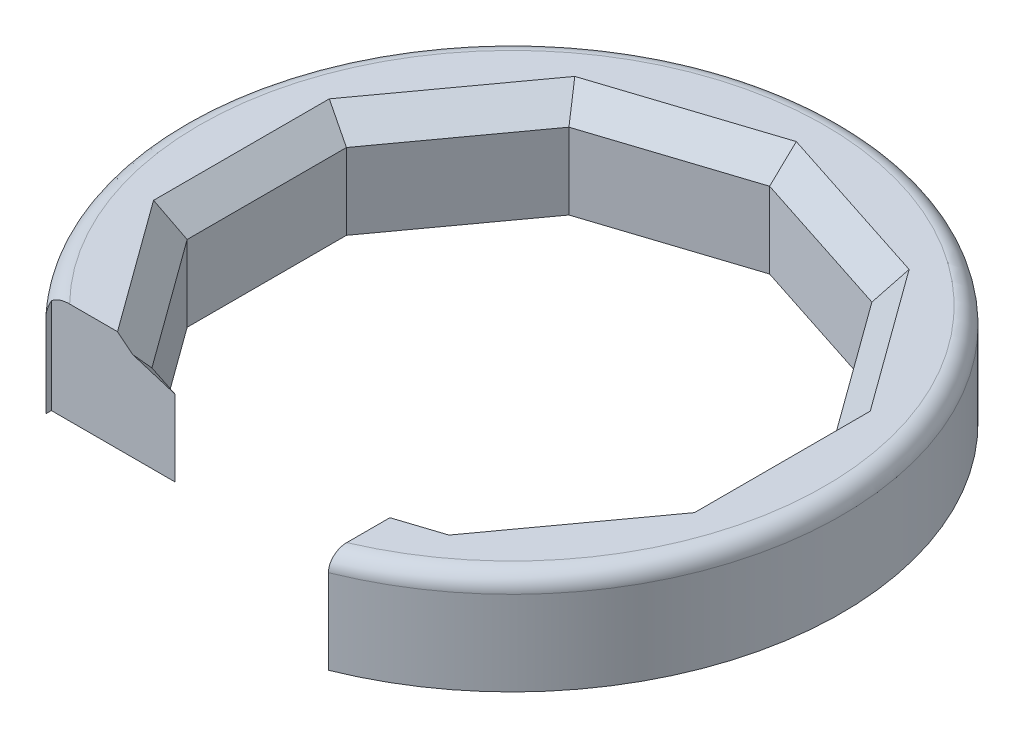
from build123d import *

# Parameters (mm, degrees)
SKETCH1_R           = 39
BOSS_EXTRUDE1_DEPTH = 12
FILLET1_R           = 2
CHAMFER1_SIZE       = 3
SKETCH2_W           = 43
SKETCH2_H           = 43
CUT_EXTRUDE2_DEPTH  = 57.444663167


with BuildPart() as part:
    # Sketch1 → Boss-Extrude1 (new body)
    with BuildSketch(Plane(origin=(0, 0, 0), x_dir=(1, 0, 0), z_dir=(0, 1, 0))):
        with Locations(Location((0, 0, 0), (0, 0, 270))):
            Circle(SKETCH1_R)
        Polygon((17.922985674, 24.668873442), (0, 30.492404503), (-17.922985674, 24.668873442), (-29, 9.422671191), (-29, -9.422671191), (-17.922985674, -24.668873442), (0, -30.492404503), (17.922985674, -24.668873442), (29, -9.422671191), (29, 9.422671191), align=None, mode=Mode.SUBTRACT)
    extrude(amount=BOSS_EXTRUDE1_DEPTH)

    # Fillet1
    fillet1_edges = [part.edges().sort_by_distance(p)[0] for p in [
        (0, 12, -39),
    ]]
    fillet(fillet1_edges, radius=FILLET1_R)

    # Chamfer1
    chamfer1_edges = [part.edges().sort_by_distance(p)[0] for p in [
        (23.461492837, 12, -17.045772316),
        (8.961492837, 12, -27.580638973),
        (-8.961492837, 12, -27.580638973),
        (-23.461492837, 12, -17.045772316),
        (-29, 12, 0),
        (-23.461492837, 12, 17.045772316),
        (-8.961492837, 12, 27.580638973),
        (8.961492837, 12, 27.580638973),
        (23.461492837, 12, 17.045772316),
        (29, 12, 0),
    ]]
    chamfer(chamfer1_edges, length=CHAMFER1_SIZE)

    # Sketch2 → Cut-Extrude2 (cut, through all)
    with BuildSketch(Plane(origin=(0, 0, 0), x_dir=(1, 0, 0), z_dir=(0, 1, 0))):
        with Locations((-7, -47.486840282)):
            Rectangle(SKETCH2_W, SKETCH2_H)
    extrude(amount=CUT_EXTRUDE2_DEPTH, mode=Mode.SUBTRACT)


solid = part.part
